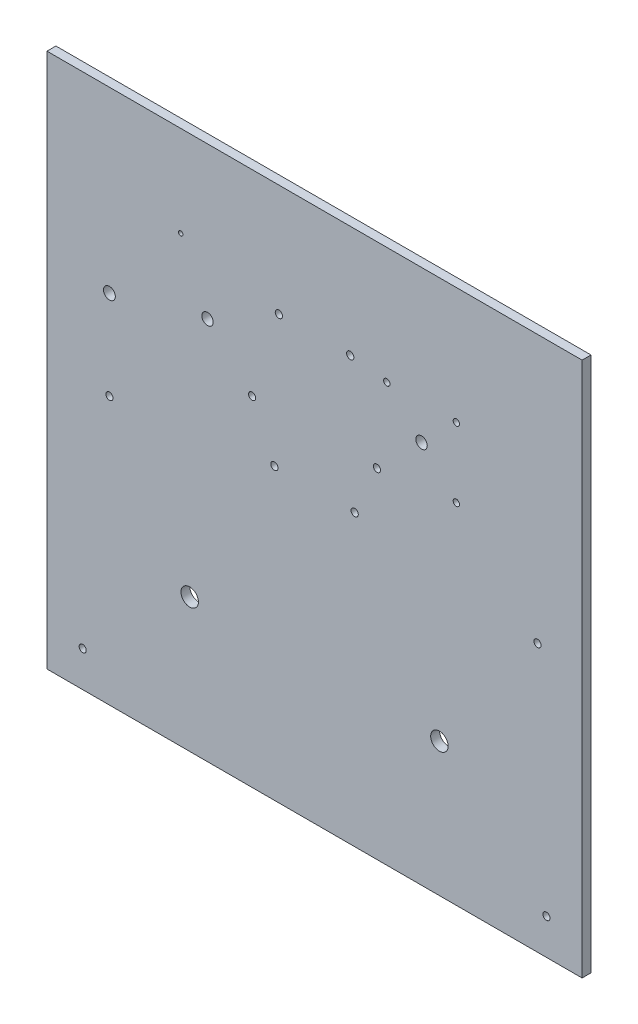
from build123d import *

# Parameters (mm, degrees)
SKETCH1_W               = 381
SKETCH1_H               = 381
SKETCH1_R               = 4.064
SKETCH1_R_2             = 2.54
SKETCH1_R_3             = 6.223
SKETCH1_R_4             = 2.25
SKETCH1_R_5             = 2.5796875
SKETCH1_R_6             = 1.5875
BOSS_EXTRUDE1_DEPTH     = 6.35
F_3_8_24_TAPPED_HOLE2_D = 8.4328


with BuildPart() as part:
    # Sketch1 → Boss-Extrude1 (new body)
    with BuildSketch(Plane.XY):
        with Locations((0, 190.5)):
            Rectangle(SKETCH1_W, SKETCH1_H)
        with Locations((76.2, 273.05)):
            Circle(SKETCH1_R, mode=Mode.SUBTRACT)
        with Locations((44.45, 241.3)):
            Circle(SKETCH1_R_2, mode=Mode.SUBTRACT)
        with Locations((88.9, 95.25)):
            Circle(SKETCH1_R_3, mode=Mode.SUBTRACT)
        with Locations(Location((-165.1, 25.4, 0), (0, 0, 180))):
            Circle(SKETCH1_R_2, mode=Mode.SUBTRACT)
        with Locations((100.948737342, 297.798737342)):
            Circle(SKETCH1_R_4, mode=Mode.SUBTRACT)
        with Locations((158.75, 190.5)):
            Circle(SKETCH1_R_2, mode=Mode.SUBTRACT)
        with Locations((51.451262658, 297.798737342)):
            Circle(SKETCH1_R_4, mode=Mode.SUBTRACT)
        with Locations((165.1, 25.4)):
            Circle(SKETCH1_R_2, mode=Mode.SUBTRACT)
        with Locations(Location((-88.9, 95.25, 0), (0, 0, 180))):
            Circle(SKETCH1_R_3, mode=Mode.SUBTRACT)
        with Locations((28.575, 206.115)):
            Circle(SKETCH1_R_5, mode=Mode.SUBTRACT)
        with Locations(Location((-146.05, 190.5, 0), (0, 0, 180))):
            Circle(SKETCH1_R_2, mode=Mode.SUBTRACT)
        with Locations((-25.4, 301.365)):
            Circle(SKETCH1_R_5, mode=Mode.SUBTRACT)
        with Locations((25.4, 301.365)):
            Circle(SKETCH1_R_5, mode=Mode.SUBTRACT)
        with Locations(Location((-44.45, 241.3, 0), (0, 0, 180))):
            Circle(SKETCH1_R_2, mode=Mode.SUBTRACT)
        with Locations(Location((-76.2, 273.05, 0), (0, 0, 180))):
            Circle(SKETCH1_R, mode=Mode.SUBTRACT)
        with Locations((-28.575, 206.115)):
            Circle(SKETCH1_R_5, mode=Mode.SUBTRACT)
        with Locations((-95.25, 316.23)):
            Circle(SKETCH1_R_6, mode=Mode.SUBTRACT)
        with Locations((100.948737342, 248.301262658)):
            Circle(SKETCH1_R_4, mode=Mode.SUBTRACT)
    extrude(amount=BOSS_EXTRUDE1_DEPTH)

    # 3/8-24 Tapped Hole2 (through all)
    with Locations(Plane.XY.offset(6.35)):
        with Locations((-146.05, 254)):
            Hole(F_3_8_24_TAPPED_HOLE2_D / 2)


solid = part.part
